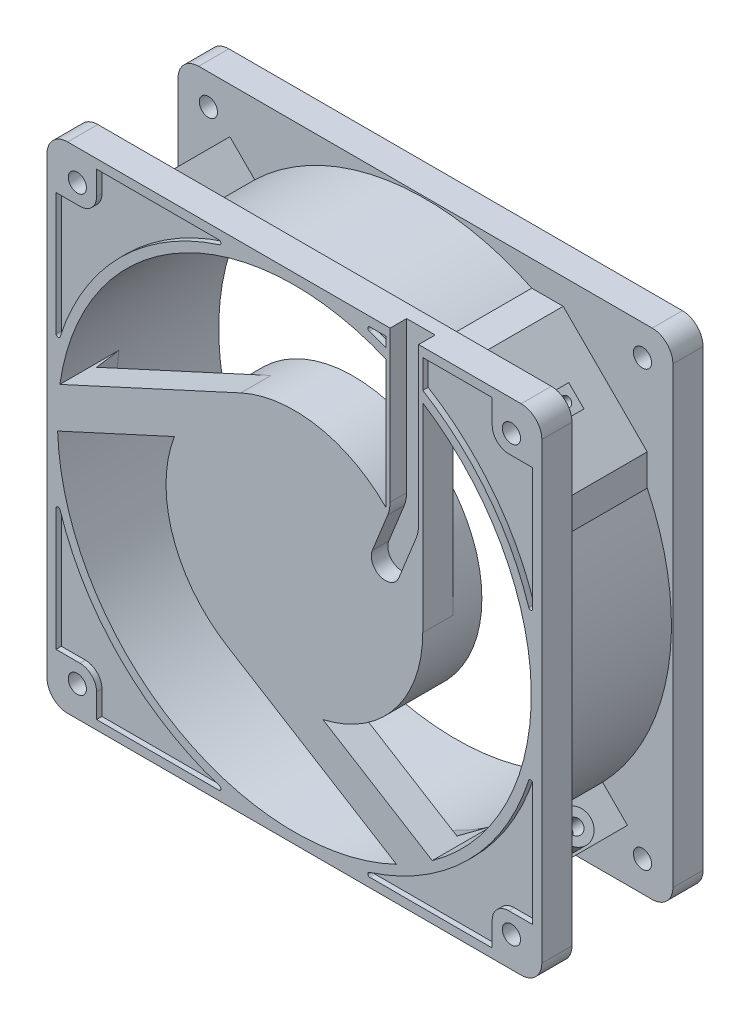
from build123d import *

# Parameters (mm, degrees)
SKETCH1_R           = 2.2
SKETCH1_R_2         = 57.3
BASE_EXTRUDE_DEPTH  = 19.5
CUT_EXTRUDE2_DEPTH  = 1.3
CUT_EXTRUDE3_DEPTH  = 12.2
SKETCH4_W           = 5.2
SKETCH4_H           = 5.2
SKETCH4_R           = 1.2
BOSS_EXTRUDE2_DEPTH = 3.7
SKETCH5_R           = 3.7
SKETCH5_R_2         = 1.7
BOSS_EXTRUDE3_DEPTH = 3.7
BOSS_EXTRUDE4_START = -14.3
BOSS_EXTRUDE4_DEPTH = 14.3
CUT_EXTRUDE6_START  = -7
CUT_EXTRUDE6_DEPTH  = 7
SKETCH10_R          = 4.5
BOSS_EXTRUDE5_DEPTH = 7
CUT_EXTRUDE7_DEPTH  = 4


with BuildPart() as part:
    # Sketch1 → Base-Extrude (new, symmetric)
    with BuildSketch(Plane.XY):
        with BuildLine():
            Line((-54.85, 59.85), (54.85, 59.85))
            ThreePointArc((54.85, 59.85), (58.385533906, 58.385533906), (59.85, 54.85))
            Line((59.85, 54.85), (59.85, -54.85))
            ThreePointArc((59.85, -54.85), (58.385533906, -58.385533906), (54.85, -59.85))
            Line((54.85, -59.85), (-54.85, -59.85))
            ThreePointArc((-54.85, -59.85), (-58.385533906, -58.385533906), (-59.85, -54.85))
            Line((-59.85, -54.85), (-59.85, 54.85))
            ThreePointArc((-59.85, 54.85), (-58.385533906, 58.385533906), (-54.85, 59.85))
        make_face()
        with Locations((-52.5, 52.5)):
            Circle(SKETCH1_R, mode=Mode.SUBTRACT)
        with Locations((52.5, 52.5)):
            Circle(SKETCH1_R, mode=Mode.SUBTRACT)
        with Locations((52.5, -52.5)):
            Circle(SKETCH1_R, mode=Mode.SUBTRACT)
        with Locations((-52.5, -52.5)):
            Circle(SKETCH1_R, mode=Mode.SUBTRACT)
        Circle(SKETCH1_R_2, mode=Mode.SUBTRACT)
    extrude(amount=BASE_EXTRUDE_DEPTH, both=True)

    # Sketch2 → Cut-Extrude2 (cut)
    with BuildSketch(Plane.XY.offset(19.5)):
        with BuildLine():
            Line((-18.272315124, 57.65), (-47.85, 57.65))
            Line((-47.85, 57.65), (-47.85, 51.85))
            ThreePointArc((-47.85, 51.85), (-49.021572875, 49.021572875), (-51.85, 47.85))
            Line((-51.85, 47.85), (-57.65, 47.85))
            Line((-57.65, 47.85), (-57.65, 18.272315124))
            ThreePointArc((-57.65, 18.272315124), (-57.227055175, 17.778288303), (-56.67375, 18.120045832))
            ThreePointArc((-56.67375, 18.120045832), (-42.072853481, 42.072853481), (-18.120045832, 56.67375))
            ThreePointArc((-18.120045832, 56.67375), (-17.778288303, 57.227055175), (-18.272315124, 57.65))
        make_face()
        with BuildLine():
            Line((57.65, 18.272315124), (57.65, 47.85))
            Line((57.65, 47.85), (51.85, 47.85))
            ThreePointArc((51.85, 47.85), (49.021572875, 49.021572875), (47.85, 51.85))
            Line((47.85, 51.85), (47.85, 57.65))
            Line((47.85, 57.65), (18.272315124, 57.65))
            ThreePointArc((18.272315124, 57.65), (17.778288303, 57.227055175), (18.120045832, 56.67375))
            ThreePointArc((18.120045832, 56.67375), (42.072853481, 42.072853481), (56.67375, 18.120045832))
            ThreePointArc((56.67375, 18.120045832), (57.227055175, 17.778288303), (57.65, 18.272315124))
        make_face()
        with BuildLine():
            Line((18.272315124, -57.65), (47.85, -57.65))
            Line((47.85, -57.65), (47.85, -51.85))
            ThreePointArc((47.85, -51.85), (49.021572875, -49.021572875), (51.85, -47.85))
            Line((51.85, -47.85), (57.65, -47.85))
            Line((57.65, -47.85), (57.65, -18.272315124))
            ThreePointArc((57.65, -18.272315124), (57.227055175, -17.778288303), (56.67375, -18.120045832))
            ThreePointArc((56.67375, -18.120045832), (42.072853481, -42.072853481), (18.120045832, -56.67375))
            ThreePointArc((18.120045832, -56.67375), (17.778288303, -57.227055175), (18.272315124, -57.65))
        make_face()
        with BuildLine():
            Line((-57.65, -18.272315124), (-57.65, -47.85))
            Line((-57.65, -47.85), (-51.85, -47.85))
            ThreePointArc((-51.85, -47.85), (-49.021572875, -49.021572875), (-47.85, -51.85))
            Line((-47.85, -51.85), (-47.85, -57.65))
            Line((-47.85, -57.65), (-18.272315124, -57.65))
            ThreePointArc((-18.272315124, -57.65), (-17.778288303, -57.227055175), (-18.120045832, -56.67375))
            ThreePointArc((-18.120045832, -56.67375), (-42.072853481, -42.072853481), (-56.67375, -18.120045832))
            ThreePointArc((-56.67375, -18.120045832), (-57.227055175, -17.778288303), (-57.65, -18.272315124))
        make_face()
    cut_extrude2 = extrude(amount=-CUT_EXTRUDE2_DEPTH, mode=Mode.SUBTRACT)

    # Mirror1: Cut-Extrude2 across plane
    add(cut_extrude2.mirror(Plane.XY), mode=Mode.SUBTRACT)

    # Sketch3 → Cut-Extrude3 (cut, symmetric)
    with BuildSketch(Plane.XY):
        with BuildLine():
            Line((-59.85, 54.85), (-59.85, -54.85))
            ThreePointArc((-59.85, -54.85), (-58.385533906, -58.385533906), (-54.85, -59.85))
            Line((-54.85, -59.85), (54.85, -59.85))
            ThreePointArc((54.85, -59.85), (58.385533906, -58.385533906), (59.85, -54.85))
            Line((59.85, -54.85), (59.85, 54.85))
            ThreePointArc((59.85, 54.85), (58.385533906, 58.385533906), (54.85, 59.85))
            Line((54.85, 59.85), (-54.85, 59.85))
            ThreePointArc((-54.85, 59.85), (-58.385533906, 58.385533906), (-59.85, 54.85))
        make_face()
        with BuildLine():
            Line((-48.86107858, 47.305443661), (-47.305443661, 48.86107858))
            Line((-47.305443661, 48.86107858), (-41.287845498, 42.843480416))
            ThreePointArc((-41.287845498, 42.843480416), (-9.472211459, 58.741188361), (25.727951726, 53.65))
            Line((25.727951726, 53.65), (33.324134086, 53.65))
            Line((33.324134086, 53.65), (53.65, 33.324134086))
            Line((53.65, 33.324134086), (53.65, 25.727951726))
            ThreePointArc((53.65, 25.727951726), (59.359027755, 4.093387844), (56.67375, -18.120045832))
            ThreePointArc((56.67375, -18.120045832), (51.089201626, -30.498253675), (42.843480416, -41.287845498))
            Line((42.843480416, -41.287845498), (48.86107858, -47.305443661))
            Line((48.86107858, -47.305443661), (47.305443661, -48.86107858))
            Line((47.305443661, -48.86107858), (41.287845498, -42.843480416))
            ThreePointArc((41.287845498, -42.843480416), (30.498253675, -51.089201626), (18.120045832, -56.67375))
            ThreePointArc((18.120045832, -56.67375), (-13.490953433, -57.95035958), (-41.287845498, -42.843480416))
            Line((-41.287845498, -42.843480416), (-47.305443661, -48.86107858))
            Line((-47.305443661, -48.86107858), (-48.86107858, -47.305443661))
            Line((-48.86107858, -47.305443661), (-42.843480416, -41.287845498))
            ThreePointArc((-42.843480416, -41.287845498), (-59.5, 0), (-42.843480416, 41.287845498))
            Line((-42.843480416, 41.287845498), (-48.86107858, 47.305443661))
        make_face(mode=Mode.SUBTRACT)
    extrude(amount=CUT_EXTRUDE3_DEPTH, both=True, mode=Mode.SUBTRACT)

    # Sketch4 → Boss-Extrude2 (add)
    with BuildSketch(Plane(origin=(62.561282734, 24.412851352, 0), x_dir=(0.7071067811865465, -0.7071067811865487, 0), z_dir=(-0.7071067811865487, -0.7071067811865465, 0))):
        with Locations((-26.975014521, 0)):
            Rectangle(SKETCH4_W, SKETCH4_H)
        with Locations((-26.975014521, 0)):
            Circle(SKETCH4_R, mode=Mode.SUBTRACT)
    extrude(amount=-BOSS_EXTRUDE2_DEPTH)

    # Sketch5 → Boss-Extrude3 (add)
    with BuildSketch(Plane(origin=(0.777817459, 0.777817459, 0), x_dir=(-0.7071067811865475, 0.7071067811865477, 0), z_dir=(0.7071067811865477, 0.7071067811865475, 0))):
        with Locations((-63.739831064, 0)):
            Circle(SKETCH5_R)
        with Locations((-63.739831064, 0)):
            Circle(SKETCH5_R_2, mode=Mode.SUBTRACT)
    extrude(amount=BOSS_EXTRUDE3_DEPTH)

    # Sketch6 → Boss-Extrude4 (add)
    with BuildSketch(Plane.XY.offset(19.5).offset(BOSS_EXTRUDE4_START)):
        with BuildLine():
            Line((31.05, 59.85), (31.05, 0))
            ThreePointArc((31.05, 0), (24.270497602, -19.366090111), (6.892483339, -30.275339361))
            Line((6.892483339, -30.275339361), (33.350790653, -46.594149448))
            ThreePointArc((33.350790653, -46.594149448), (29.132239471, -49.341692547), (24.688803653, -51.708345305))
            Line((24.688803653, -51.708345305), (-16.299859412, -26.427581864))
            ThreePointArc((-16.299859412, -26.427581864), (-29.402973822, -9.978358103), (-29.017884256, 11.048298208))
            Line((-29.017884256, 11.048298208), (-57.26767019, -1.924565134))
            ThreePointArc((-57.26767019, -1.924565134), (-57.215562693, 3.109563585), (-56.721782971, 8.119688208))
            Line((-56.721782971, 8.119688208), (-12.957798241, 28.216980078))
            ThreePointArc((-12.957798241, 28.216980078), (5.616813769, 30.537745547), (22.15, 21.759595584))
            Line((22.15, 21.759595584), (22.15, 59.85))
            Line((22.15, 59.85), (31.05, 59.85))
        make_face()
    extrude(amount=BOSS_EXTRUDE4_DEPTH)

    # Sketch8 → Cut-Extrude6 (cut)
    with BuildSketch(Plane(origin=(0, 0, 5.2), x_dir=(-1, 0, 0), z_dir=(0, 0, -1)).offset(CUT_EXTRUDE6_START)):
        with BuildLine():
            Line((-22.15, 55.223432526), (-22.15, 59.85))
            Line((-22.15, 59.85), (-31.05, 59.85))
            Line((-31.05, 59.85), (-31.05, 53.65))
            Line((-31.05, 53.65), (-25.727951726, 53.65))
            ThreePointArc((-25.727951726, 53.65), (-23.951899462, 54.46610425), (-22.15, 55.223432526))
        make_face()
    extrude(amount=CUT_EXTRUDE6_DEPTH, mode=Mode.SUBTRACT)

    # Sketch9 → Cut-Revolve1 (revolve, cut)
    with BuildSketch(Plane(origin=(0, 0, 0), x_dir=(0, 0, -1), z_dir=(1, 0, 0)), mode=Mode.PRIVATE) as cut_revolve1_sk:
        Polygon((-12.2, 55.85), (-5.2, 57.3), (-5.2, 31.05), (-12.2, 31.05), align=None)
    revolve(cut_revolve1_sk.sketch.rotate(Axis((0, 0, 26.328829275), (0, 0, -1)), 268.075214607), axis=Axis((0, 0, 26.328829275), (0, 0, -1)), mode=Mode.SUBTRACT)

    # Sketch10 → Boss-Extrude5 (add)
    with BuildSketch(Plane(origin=(0, 0, 5.2), x_dir=(-1, 0, 0), z_dir=(0, 0, -1))):
        with Locations(Location((0, 0, 0), (0, 0, 180))):
            Circle(SKETCH10_R)
    extrude(amount=BOSS_EXTRUDE5_DEPTH)

    # Sketch11 → Cut-Extrude7 (cut)
    with BuildSketch(Plane.XY.offset(19.5)):
        with BuildLine():
            Line((30.05, 22.037559766), (30.05, 59.85))
            Line((30.05, 59.85), (23.15, 59.85))
            Line((23.15, 59.85), (23.15, 23.373862112))
            ThreePointArc((23.15, 23.373862112), (23.004064946, 21.852788864), (22.571584043, 20.387210092))
            Line((22.571584043, 20.387210092), (18.849441881, 11.137993684))
            ThreePointArc((18.849441881, 11.137993684), (20.762006316, 6.649441881), (25.250558119, 8.562006316))
            Line((25.250558119, 8.562006316), (29.471584043, 19.050907745))
            ThreePointArc((29.471584043, 19.050907745), (29.904064946, 20.516486517), (30.05, 22.037559766))
        make_face()
    extrude(amount=-CUT_EXTRUDE7_DEPTH, mode=Mode.SUBTRACT)


solid = part.part
